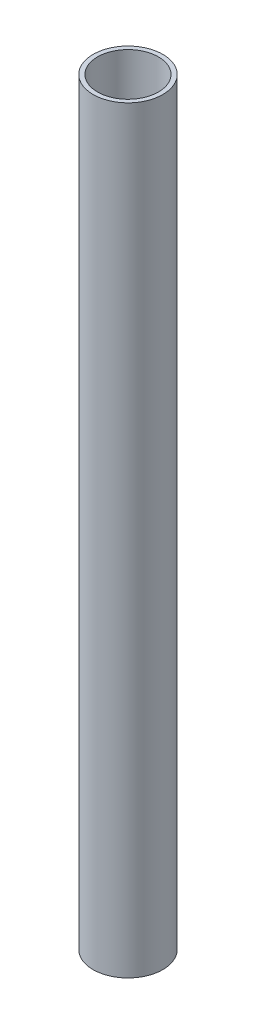
from build123d import *

# Parameters (mm, degrees)
SKETCH1_R           = 8
SKETCH1_R_2         = 7
BOSS_EXTRUDE1_DEPTH = 174.1


with BuildPart() as part:
    # Sketch1 → Boss-Extrude1 (new body)
    with BuildSketch(Plane(origin=(0, 0, 0), x_dir=(1, 0, 0), z_dir=(0, 1, 0))):
        with Locations(Location((0, 0, 0), (0, 0, 270))):
            Circle(SKETCH1_R)
        with Locations(Location((0, 0, 0), (0, 0, 270))):
            Circle(SKETCH1_R_2, mode=Mode.SUBTRACT)
    extrude(amount=BOSS_EXTRUDE1_DEPTH)


solid = part.part
